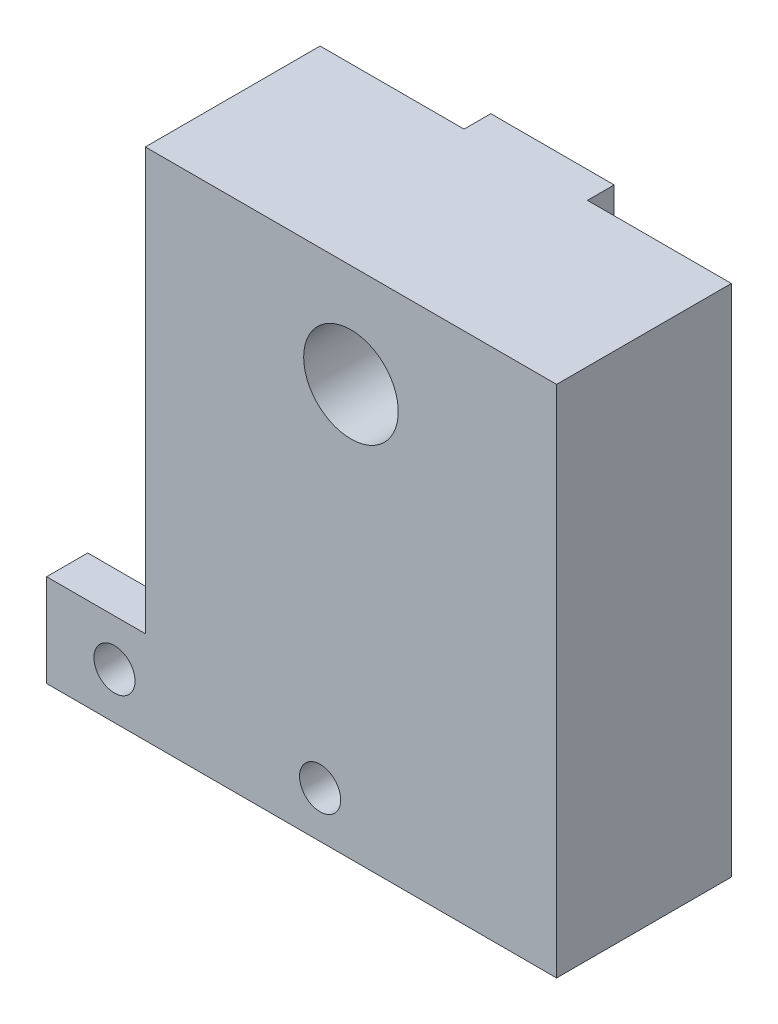
from build123d import *

# Parameters (mm, degrees)
SKETCH1_W               = 20
SKETCH1_H               = 25
BOSS_EXTRUDE1_DEPTH     = 2
SKETCH4_W               = 20
SKETCH4_H               = 10
BOSS_EXTRUDE3_DEPTH     = 6.5
SKETCH9_W               = 6
SKETCH9_H               = 10
BOSS_EXTRUDE6_DEPTH     = 1.3
CUT_EXTRUDE2_DEPTH      = 34.12476415
CUT_EXTRUDE2_DEPTH_BACK = 34.12476415
SKETCH5_R               = 2.3
SKETCH6_W               = 4.8
SKETCH6_H               = 4.5
BOSS_EXTRUDE4_DEPTH     = 2
SKETCH7_R               = 1
CUT_EXTRUDE3_DEPTH      = 10
SKETCH8_W               = 2
SKETCH8_H               = 15
BOSS_EXTRUDE5_DEPTH     = 6.5


with BuildPart() as part:
    # Sketch1 → Boss-Extrude1 (new body)
    with BuildSketch(Plane.XY):
        with Locations((10, 12.5)):
            Rectangle(SKETCH1_W, SKETCH1_H)
    extrude(amount=BOSS_EXTRUDE1_DEPTH)

    # Sketch4 → Boss-Extrude3 (add)
    with BuildSketch(Plane(origin=(0, 0, 0), x_dir=(-1, 0, 0), z_dir=(0, 0, -1))):
        with Locations((-10, 20)):
            Rectangle(SKETCH4_W, SKETCH4_H)
    extrude(amount=BOSS_EXTRUDE3_DEPTH)

    # Sketch9 → Boss-Extrude6 (add)
    with BuildSketch(Plane(origin=(0, 0, -6.5), x_dir=(-1, 0, 0), z_dir=(0, 0, -1))):
        with Locations((-10, 20)):
            Rectangle(SKETCH9_W, SKETCH9_H)
    extrude(amount=BOSS_EXTRUDE6_DEPTH)

    # Sketch5 → Cut-Extrude2 (cut, two sides: drawn at the far end of the back side and taken through both)
    with BuildSketch(Plane(origin=(0, 0, -6.5), x_dir=(-1, 0, 0), z_dir=(0, 0, -1)).offset(-CUT_EXTRUDE2_DEPTH_BACK)):
        with Locations((-10, 20)):
            Circle(SKETCH5_R)
    extrude(amount=CUT_EXTRUDE2_DEPTH + CUT_EXTRUDE2_DEPTH_BACK, mode=Mode.SUBTRACT)

    # Sketch6 → Boss-Extrude4 (add)
    with BuildSketch(Plane.XY.offset(2)):
        with Locations((-2.4, 2.25)):
            Rectangle(SKETCH6_W, SKETCH6_H)
    extrude(amount=-BOSS_EXTRUDE4_DEPTH)

    # Sketch7 → Cut-Extrude3 (cut)
    with BuildSketch(Plane(origin=(0, 0, 0), x_dir=(-1, 0, 0), z_dir=(0, 0, -1))):
        with Locations((1.5, 2.25)):
            Circle(SKETCH7_R)
        with Locations((-8.5, 2.25)):
            Circle(SKETCH7_R)
    extrude(amount=-CUT_EXTRUDE3_DEPTH, mode=Mode.SUBTRACT)

    # Sketch8 → Boss-Extrude5 (add)
    with BuildSketch(Plane(origin=(0, 0, 0), x_dir=(-1, 0, 0), z_dir=(0, 0, -1))):
        with Locations((-19, 7.5)):
            Rectangle(SKETCH8_W, SKETCH8_H)
    extrude(amount=BOSS_EXTRUDE5_DEPTH)


solid = part.part
